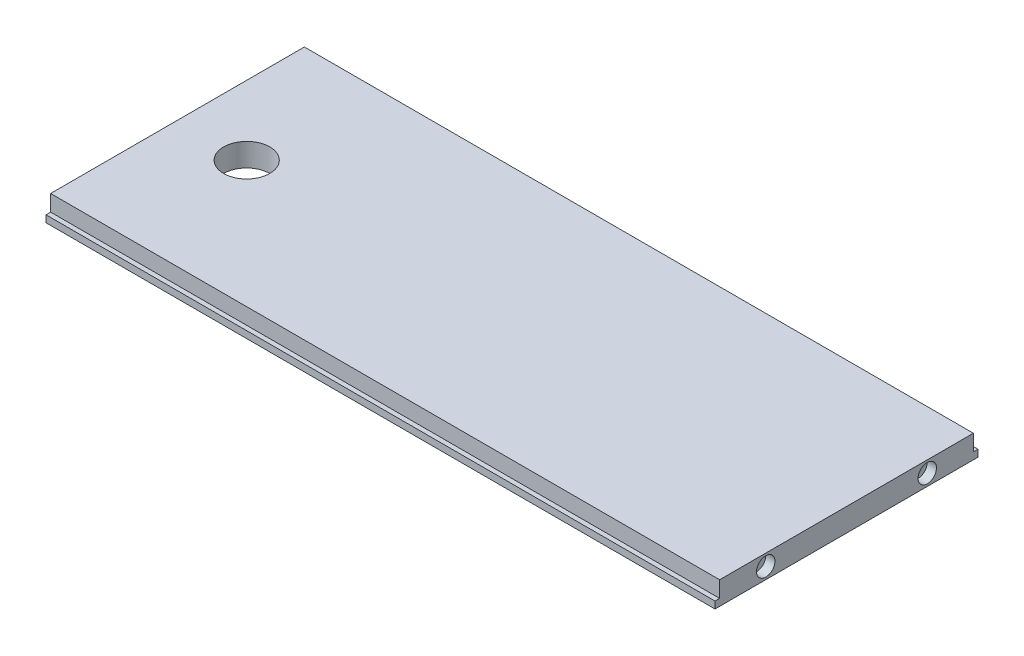
from build123d import *

# Parameters (mm, degrees)
SKETCH1_W           = 290
SKETCH1_H           = 114
BOSS_EXTRUDE1_DEPTH = 10
SKETCH2_W           = 290
SKETCH2_H           = 2
CUT_EXTRUDE1_DEPTH  = 7
SKETCH3_R           = 4
CUT_EXTRUDE2_DEPTH  = 4
SKETCH4_R           = 10
CUT_EXTRUDE3_DEPTH  = 10


with BuildPart() as part:
    # Sketch1 → Boss-Extrude1 (new body)
    with BuildSketch(Plane(origin=(0, 0, 0), x_dir=(1, 0, 0), z_dir=(0, 1, 0))):
        with Locations((145, 57)):
            Rectangle(SKETCH1_W, SKETCH1_H)
    extrude(amount=BOSS_EXTRUDE1_DEPTH)

    # Sketch2 → Cut-Extrude1 (cut)
    with BuildSketch(Plane(origin=(0, 10, 0), x_dir=(1, 0, 0), z_dir=(0, 1, 0))):
        with Locations((145, 113)):
            Rectangle(SKETCH2_W, SKETCH2_H)
        with Locations((145, 1)):
            Rectangle(SKETCH2_W, SKETCH2_H)
    extrude(amount=-CUT_EXTRUDE1_DEPTH, mode=Mode.SUBTRACT)

    # Sketch3 → Cut-Extrude2 (cut)
    with BuildSketch(Plane(origin=(290, 0, 0), x_dir=(0, 0, -1), z_dir=(1, 0, 0))):
        with Locations((22, 5)):
            Circle(SKETCH3_R)
        with Locations((92, 5)):
            Circle(SKETCH3_R)
    extrude(amount=-CUT_EXTRUDE2_DEPTH, mode=Mode.SUBTRACT)

    # Sketch4 → Cut-Extrude3 (cut)
    with BuildSketch(Plane(origin=(0, 10, 0), x_dir=(1, 0, 0), z_dir=(0, 1, 0))):
        with Locations(Location((30, 57, 0), (0, 0, 270))):
            Circle(SKETCH4_R)
    extrude(amount=-CUT_EXTRUDE3_DEPTH, mode=Mode.SUBTRACT)


solid = part.part
